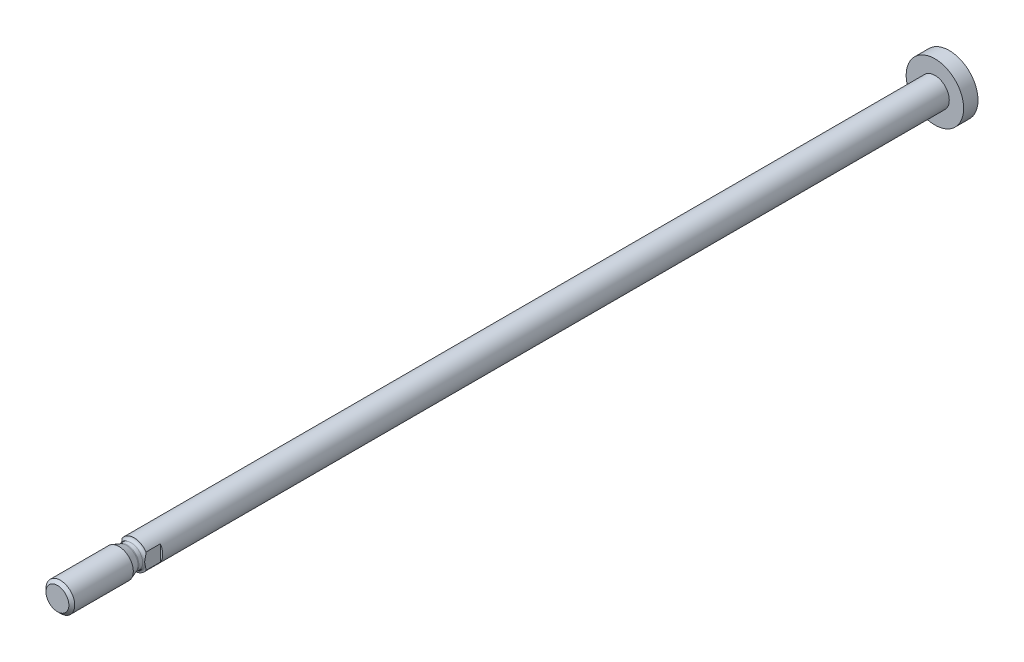
from build123d import *

# Parameters (mm, degrees)
SCHNITT_LINEAR_AUSTRAGEN1_DEPTH = 4


with BuildPart() as part:
    # Skizze1 → Rotation1 (revolve)
    with BuildSketch(Plane(origin=(0, 0, 0), x_dir=(0, 0, -1), z_dir=(1, 0, 0)), mode=Mode.PRIVATE) as rotation1_sk:
        Polygon((-5, 0), (-5, 3), (162.3, 3), (162.3, 6), (165.3, 6), (165.3, 0), align=None)
    revolve(rotation1_sk.sketch.rotate(Axis((0, 0, -165.3), (0, 0, 1)), 270), axis=Axis((0, 0, -165.3), (0, 0, 1)))

    # Skizze2 → Rotation2 (revolve)
    with BuildSketch(Plane(origin=(0, 0, 0), x_dir=(0, 0, -1), z_dir=(1, 0, 0)), mode=Mode.PRIVATE) as rotation2_sk:
        with BuildLine():
            Line((-21, 0), (-21, 2.3865))
            Line((-21, 2.3865), (-20.3865, 3))
            Line((-20.3865, 3), (-8.148486452, 3))
            Line((-8.148486452, 3), (-6.599415898, 2.436184428))
            ThreePointArc((-6.599415898, 2.436184428), (-6.498392718, 2.409115348), (-6.394203812, 2.4))
            Line((-6.394203812, 2.4), (-5.6, 2.4))
            ThreePointArc((-5.6, 2.4), (-5.175735931, 2.575735931), (-5, 3))
            Line((-5, 3), (-4, 3))
            Line((-4, 3), (-4, 0))
            Line((-4, 0), (-21, 0))
        make_face()
    revolve(rotation2_sk.sketch.rotate(Axis((0, 0, 4), (0, 0, 1)), 270), axis=Axis((0, 0, 4), (0, 0, 1)))

    # Skizze3 → Schnitt-Linear austragen1 (cut)
    with BuildSketch(Plane.XY.offset(2)):
        Polygon((-5, 10), (-5, -5), (-2.5, -5), (-2.5, 5), (2.5, 5), (2.5, -5), (5, -5), (5, 10), align=None)
    extrude(amount=SCHNITT_LINEAR_AUSTRAGEN1_DEPTH, mode=Mode.SUBTRACT)


solid = part.part
